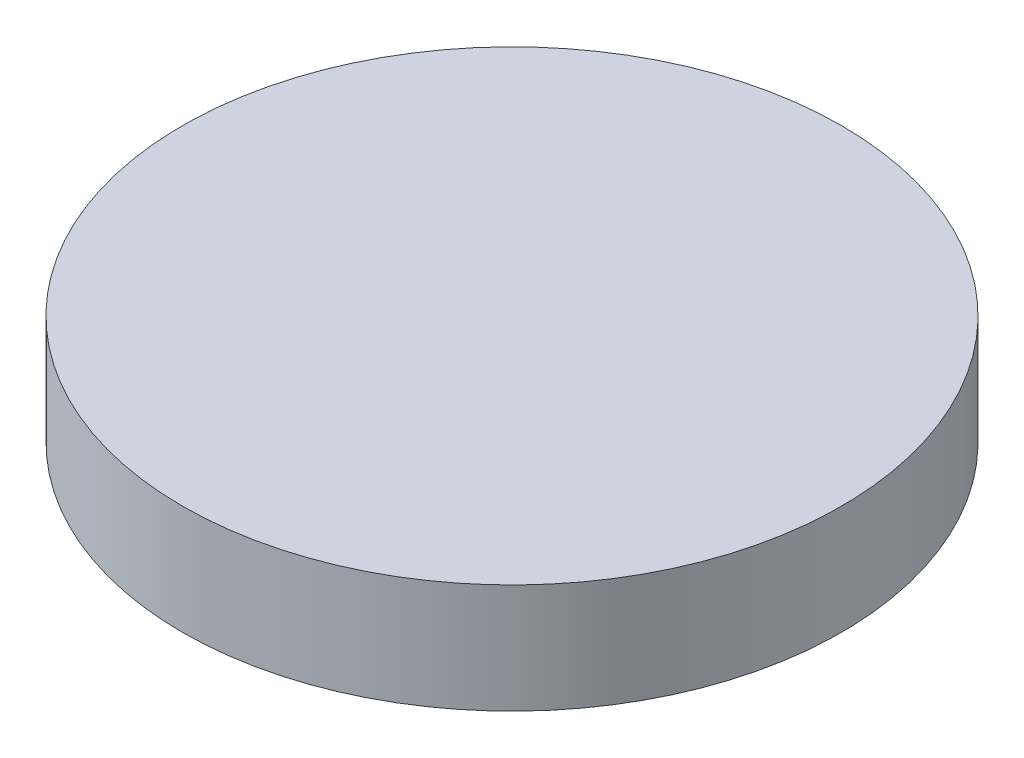
from build123d import *

# Parameters (mm, degrees)
SKETCH_4_R      = 4.975
EXTRUDE_1_DEPTH = 1.65


with BuildPart() as part:
    # 草图4 → 凸台-拉伸1 (new body)
    with BuildSketch(Plane(origin=(0, 0, 0), x_dir=(1, 0, 0), z_dir=(0, 1, 0))):
        with Locations(Location((0, 0, 0), (0, 0, 270))):
            Circle(SKETCH_4_R)
    extrude(amount=EXTRUDE_1_DEPTH)


solid = part.part
